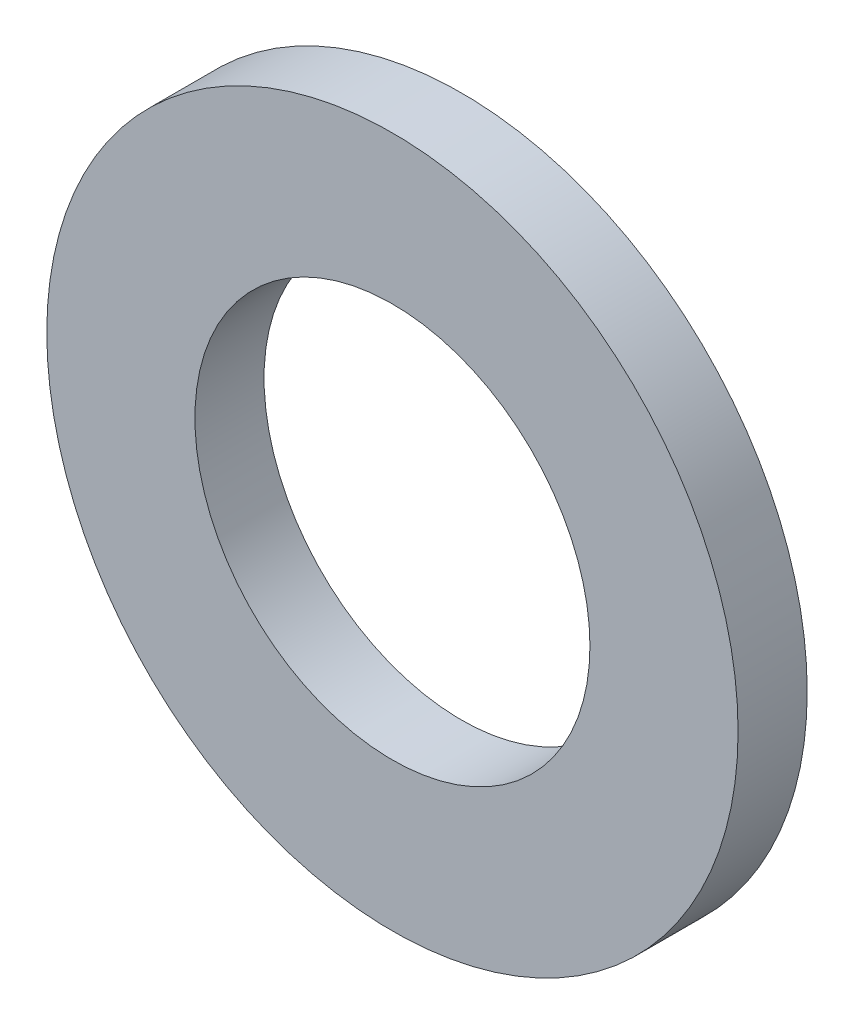
from build123d import *

# Parameters (mm, degrees)
SKETCH_1_R      = 3.5
SKETCH_1_R_2    = 2
EXTRUDE_1_DEPTH = 0.7


with BuildPart() as part:
    # 草图1 → 凸台-拉伸1 (new body)
    with BuildSketch(Plane.XY):
        Circle(SKETCH_1_R)
        Circle(SKETCH_1_R_2, mode=Mode.SUBTRACT)
    extrude(amount=EXTRUDE_1_DEPTH)


solid = part.part
